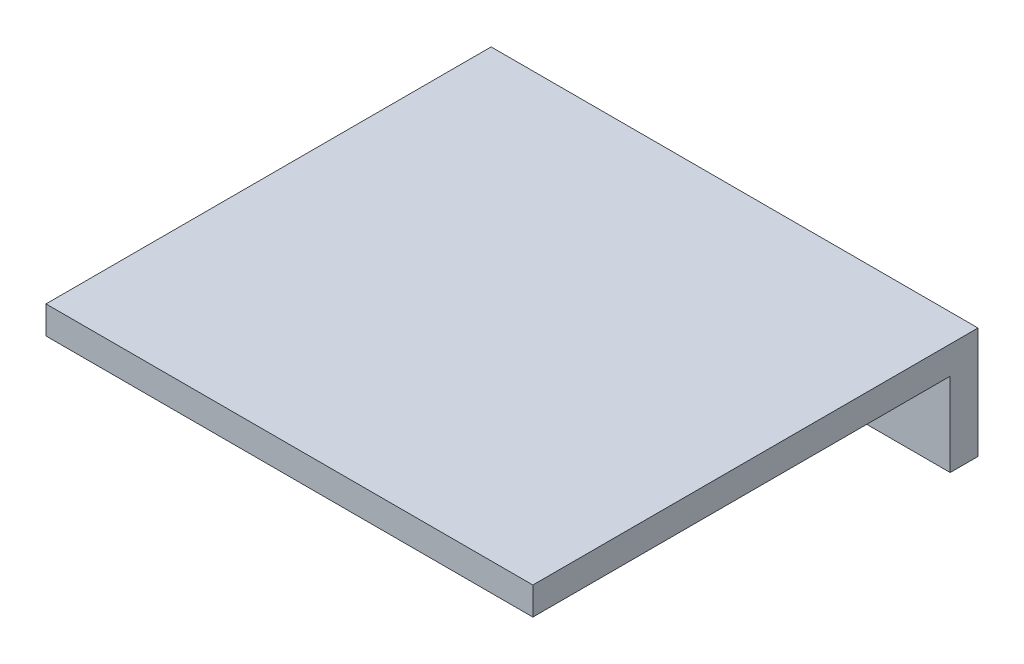
from build123d import *

# Parameters (mm, degrees)
SKETCH1_W           = 35
SKETCH1_H           = 8
SKETCH1_R           = 1.35
BOSS_EXTRUDE1_DEPTH = 2
SKETCH2_W           = 35
SKETCH2_H           = 2
BOSS_EXTRUDE3_DEPTH = 30


with BuildPart() as part:
    # Sketch1 → Boss-Extrude1 (new body)
    with BuildSketch(Plane.XY):
        Rectangle(SKETCH1_W, SKETCH1_H)
        with Locations((12, 0)):
            Circle(SKETCH1_R, mode=Mode.SUBTRACT)
        with Locations(Location((-12, 0, 0), (0, 0, 180))):
            Circle(SKETCH1_R, mode=Mode.SUBTRACT)
    extrude(amount=BOSS_EXTRUDE1_DEPTH)

    # Sketch2 → Boss-Extrude3 (add)
    with BuildSketch(Plane.XY.offset(2)):
        with Locations((0, 3)):
            Rectangle(SKETCH2_W, SKETCH2_H)
    extrude(amount=BOSS_EXTRUDE3_DEPTH)


solid = part.part
